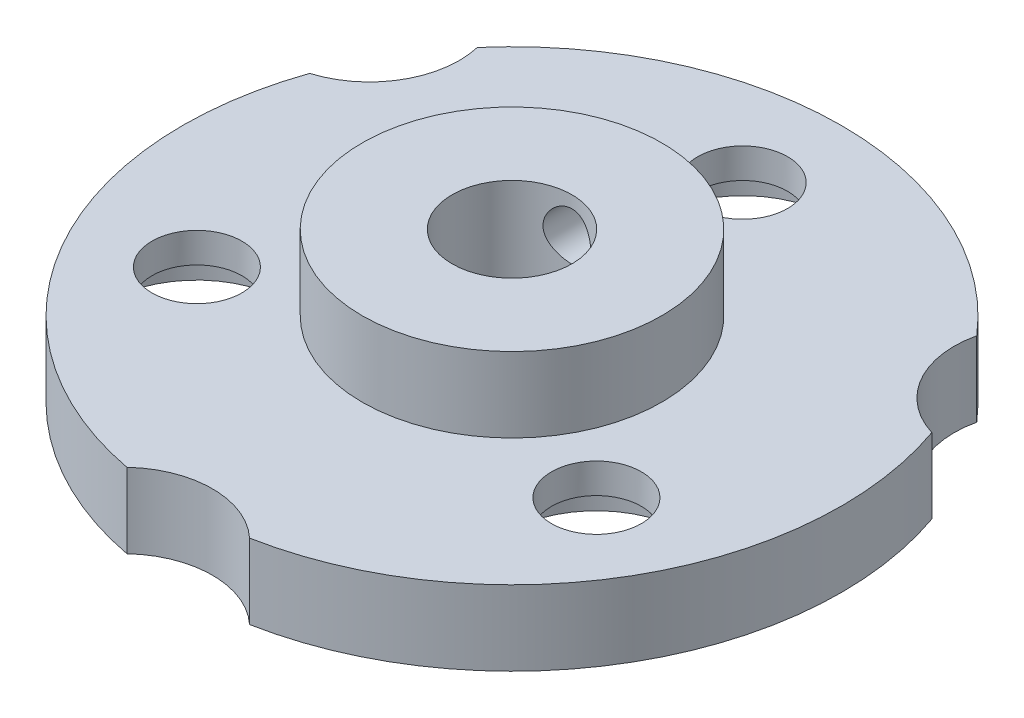
from build123d import *

# Parameters (mm, degrees)
ESBO_O1_R                                      = 11
RESSALTO_EXTRUS_O1_DEPTH                       = 2.5
ESBO_O3_R                                      = 1.5
CORTE_EXTRUS_O1_DEPTH                          = 2.5
ESBO_O18_R                                     = 5
RESSALTO_EXTRUS_O5_DEPTH                       = 2.5
ESBO_O20_R                                     = 2
CORTE_EXTRUS_O5_DEPTH                          = 5.5
BROCA_DE_ROSQUEAR_PARA_TARRAXA_DE_M2X0_4_REACH = 21.785
BROCA_DE_ROSQUEAR_PARA_TARRAXA_DE_M2_2_R       = 0.8
ESBO_O22_R                                     = 3
CORTE_EXTRUS_O6_DEPTH                          = 5.5
ESBO_O23_R                                     = 3
CORTE_EXTRUS_O7_DEPTH                          = 1.5


with BuildPart() as part:
    # Esboço1 → Ressalto-extrusão1 (new body)
    with BuildSketch(Plane(origin=(0, 0, 0), x_dir=(1, 0, 0), z_dir=(0, 1, 0))):
        with Locations(Location((0, 0, 0), (0, 0, 270))):
            Circle(ESBO_O1_R)
    extrude(amount=RESSALTO_EXTRUS_O1_DEPTH)

    # Esboço3 → Corte-extrusão1 (cut)
    with BuildSketch(Plane(origin=(0, 2.5, 0), x_dir=(1, 0, 0), z_dir=(0, 1, 0))):
        with Locations(Location((0, 7.7, 0), (0, 0, 270))):
            Circle(ESBO_O3_R)
        with Locations(Location((6.668395609, -3.85, 0), (0, 0, 270))):
            Circle(ESBO_O3_R)
        with Locations(Location((-6.668395609, -3.85, 0), (0, 0, 270))):
            Circle(ESBO_O3_R)
    extrude(amount=-CORTE_EXTRUS_O1_DEPTH, mode=Mode.SUBTRACT)

    # Esboço18 → Ressalto-extrusão5 (add)
    with BuildSketch(Plane(origin=(0, 2.5, 0), x_dir=(1, 0, 0), z_dir=(0, 1, 0))):
        with Locations(Location((0, 0, 0), (0, 0, 270))):
            Circle(ESBO_O18_R)
    extrude(amount=RESSALTO_EXTRUS_O5_DEPTH)

    # Esboço20 → Corte-extrusão5 (cut)
    with BuildSketch(Plane(origin=(0, 5, 0), x_dir=(1, 0, 0), z_dir=(0, 1, 0))):
        with Locations(Location((0, 0, 0), (0, 0, 270))):
            Circle(ESBO_O20_R)
    extrude(amount=-CORTE_EXTRUS_O5_DEPTH, mode=Mode.SUBTRACT)

    # Broca de rosquear para tarraxa de M2 2 (on position points) → Broca de rosquear para tarraxa de M2x0.42 (cut, up to next)
    with BuildSketch(Plane(origin=(0.002598781, 3.792959438, -4.999999325), x_dir=(-0.999999864927, 0, -0.000519756122), z_dir=(0.000519756122, 0, -0.999999864927)), mode=Mode.PRIVATE) as broca_de_rosquear_para_tarraxa_de_m2x0_4_sk1:
        Circle(BROCA_DE_ROSQUEAR_PARA_TARRAXA_DE_M2_2_R)
    broca_de_rosquear_para_tarraxa_de_m2x0_4_tool1 = extrude(broca_de_rosquear_para_tarraxa_de_m2x0_4_sk1.sketch, amount=-BROCA_DE_ROSQUEAR_PARA_TARRAXA_DE_M2X0_4_REACH, mode=Mode.PRIVATE) & part.part
    add(broca_de_rosquear_para_tarraxa_de_m2x0_4_tool1.solids().sort_by_distance((0.002599, 3.792959, -4.999999))[0], mode=Mode.SUBTRACT)

    # Esboço22 → Corte-extrusão6 (cut)
    with BuildSketch(Plane(origin=(0, 2.5, 0), x_dir=(1, 0, 0), z_dir=(0, 1, 0))):
        with Locations((-11.258330249, 6.5)):
            Circle(ESBO_O22_R)
        with Locations((0, -13)):
            Circle(ESBO_O22_R)
        with Locations((11.258330249, 6.5)):
            Circle(ESBO_O22_R)
    extrude(amount=-CORTE_EXTRUS_O6_DEPTH, mode=Mode.SUBTRACT)

    # Esboço23 → Corte-extrusão7 (cut)
    with BuildSketch(Plane(origin=(0, 0, 0), x_dir=(-1, 0, 0), z_dir=(0, -1, 0))):
        with Locations(Location((-6.668395609, -3.85, 0), (0, 0, 90))):
            Circle(ESBO_O23_R)
        with Locations(Location((6.668395609, -3.85, 0), (0, 0, 90))):
            Circle(ESBO_O23_R)
        with Locations(Location((0, 7.7, 0), (0, 0, 90))):
            Circle(ESBO_O23_R)
    extrude(amount=-CORTE_EXTRUS_O7_DEPTH, mode=Mode.SUBTRACT)


solid = part.part
